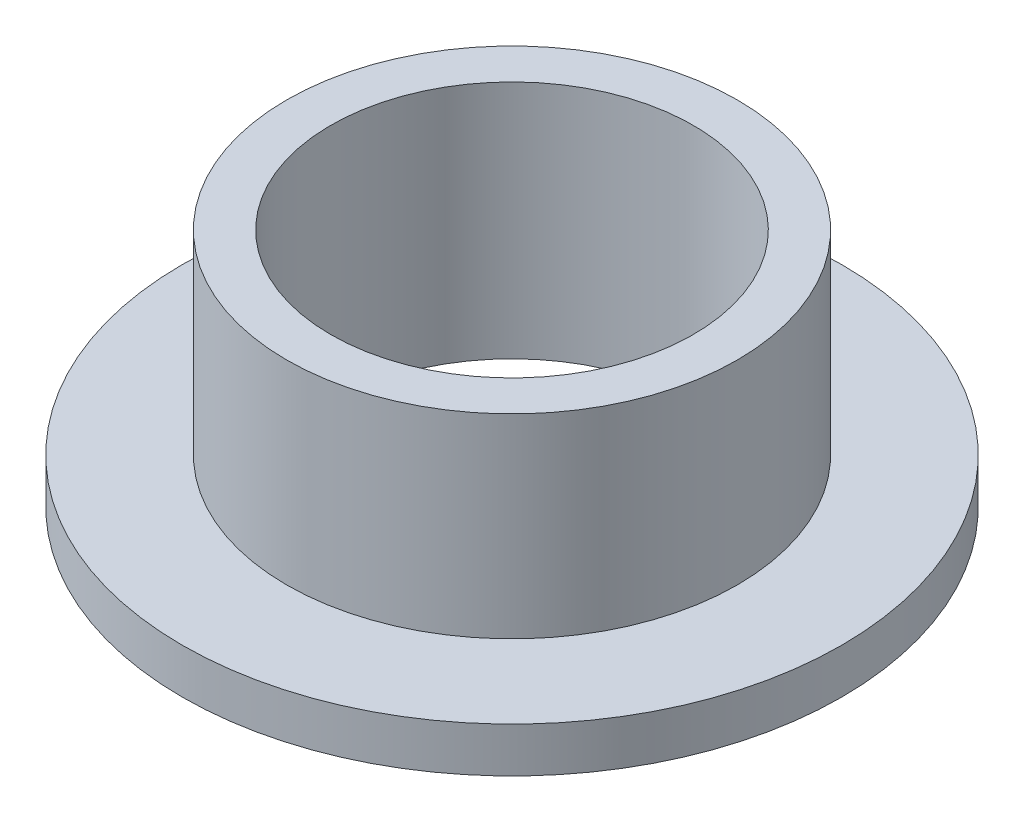
from build123d import *

# Parameters (mm, degrees)
SKETCH2_R           = 5.96646
SKETCH2_R_2         = 4.8006
BOSS_EXTRUDE1_DEPTH = 6.35
SKETCH3_R           = 8.73125
SKETCH3_R_2         = 5.96646
BOSS_EXTRUDE2_DEPTH = 1.190625


with BuildPart() as part:
    # Sketch2 → Boss-Extrude1 (new body)
    with BuildSketch(Plane(origin=(0, 0, 0), x_dir=(1, 0, 0), z_dir=(0, 1, 0))):
        with Locations(Location((0, 0, 0), (0, 0, 270))):
            Circle(SKETCH2_R)
        with Locations(Location((0, 0, 0), (0, 0, 270))):
            Circle(SKETCH2_R_2, mode=Mode.SUBTRACT)
    extrude(amount=BOSS_EXTRUDE1_DEPTH)

    # Sketch3 → Boss-Extrude2 (add)
    with BuildSketch(Plane(origin=(0, 0, 0), x_dir=(1, 0, 0), z_dir=(0, 1, 0))):
        with Locations(Location((0, 0, 0), (0, 0, 90))):
            Circle(SKETCH3_R)
        with Locations(Location((0, 0, 0), (0, 0, 270))):
            Circle(SKETCH3_R_2, mode=Mode.SUBTRACT)
    extrude(amount=BOSS_EXTRUDE2_DEPTH)


solid = part.part
